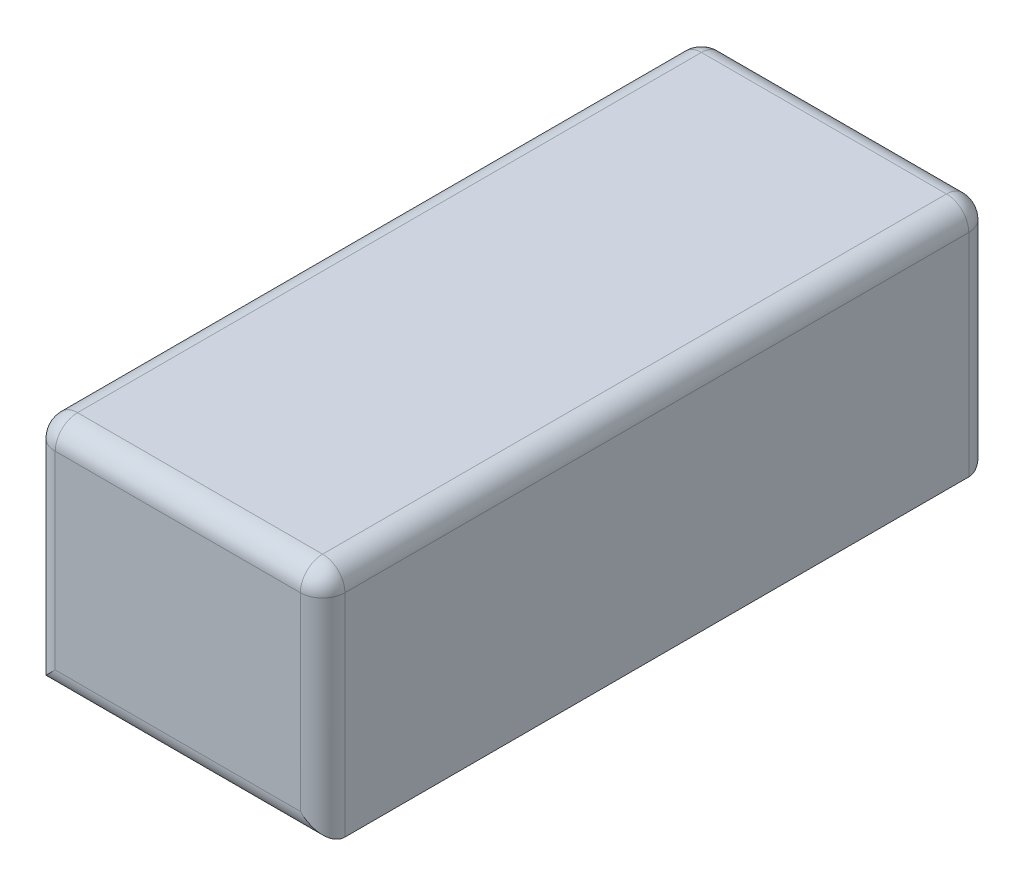
from build123d import *

# Parameters (mm, degrees)
SKETCH_1_W      = 26
SKETCH_1_H      = 21
EXTRUDE_1_DEPTH = 60
FILLET_1_R      = 2


with BuildPart() as part:
    # 草图1 → 凸台-拉伸1 (new body)
    with BuildSketch(Plane.XY):
        Rectangle(SKETCH_1_W, SKETCH_1_H)
    extrude(amount=EXTRUDE_1_DEPTH)

    # 圆角1
    fillet_1_edges = [part.edges().sort_by_distance(p)[0] for p in [
        (-13, 0, 60),
        (0, -10.5, 60),
        (13, 0, 60),
        (0, -10.5, 0),
        (-13, 0, 0),
        (0, 10.5, 0),
        (13, 0, 0),
        (-13, 10.5, 30),
        (13, 10.5, 30),
        (0, 10.5, 60),
    ]]
    fillet(fillet_1_edges, radius=FILLET_1_R)


solid = part.part
